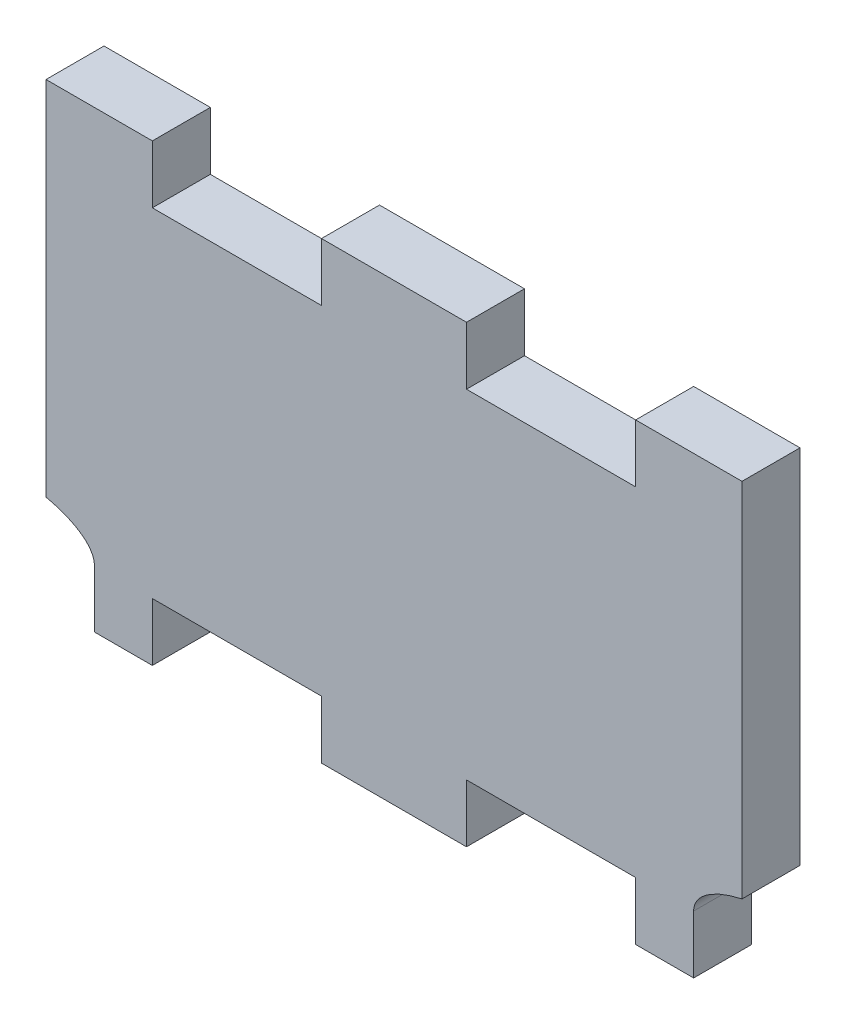
from build123d import *

# Parameters (mm, degrees)
BOSS_EXTRUDE1_DEPTH = 6


with BuildPart() as part:
    # Sketch2 → Boss-Extrude1 (new body)
    with BuildSketch(Plane.XY):
        with BuildLine():
            Line((-15, 0), (-9, 0))
            Line((-9, 0), (-9, 6))
            add(Edge.make_bspline(
                [(-4, 9.583225666), (-9, 8.480694692), (-9, 6)],
                knots=[5.172942972, 5.172942972, 5.172942972, 6.283185307, 6.283185307, 6.283185307], degree=2, weights=[1, 0.849836586, 1]))
            Line((-4, 9.583225666), (-4, 41))
            Line((-4, 41), (-4, 47))
            Line((-4, 47), (-15, 47))
            Line((-15, 47), (-15, 41))
            Line((-15, 41), (-32.5, 41))
            Line((-32.5, 41), (-32.5, 47))
            Line((-32.5, 47), (-47.5, 47))
            Line((-47.5, 47), (-47.5, 41))
            Line((-47.5, 41), (-65, 41))
            Line((-65, 41), (-65, 47))
            Line((-65, 47), (-76, 47))
            Line((-76, 47), (-76, 41))
            Line((-76, 41), (-76, 9.583225666))
            add(Edge.make_bspline(
                [(-71, 6), (-71, 8.480694692), (-76, 9.583225666)],
                knots=[0, 0, 0, 1.110242335, 1.110242335, 1.110242335], degree=2, weights=[1, 0.849836586, 1]))
            Line((-71, 6), (-71, 0))
            Line((-71, 0), (-65, 0))
            Line((-65, 0), (-65, 6))
            Line((-65, 6), (-47.5, 6))
            Line((-47.5, 6), (-47.5, 0))
            Line((-47.5, 0), (-32.5, 0))
            Line((-32.5, 0), (-32.5, 6))
            Line((-32.5, 6), (-15, 6))
            Line((-15, 6), (-15, 0))
        make_face()
    extrude(amount=BOSS_EXTRUDE1_DEPTH)


solid = part.part
